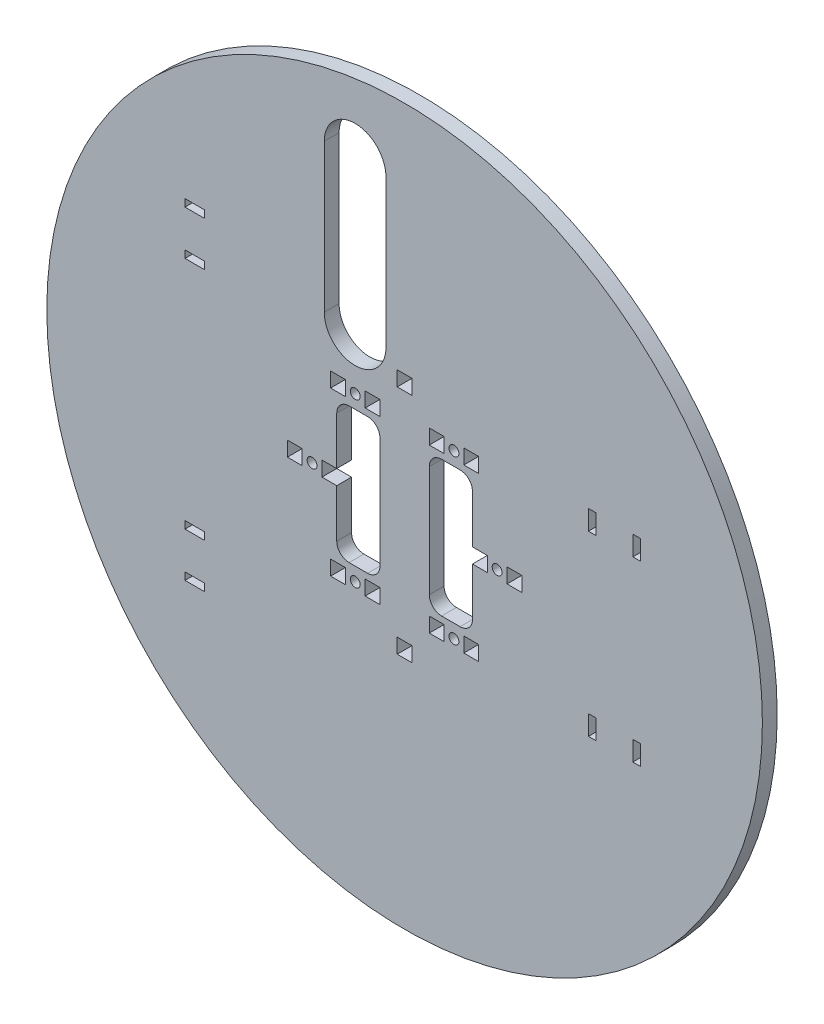
from build123d import *

# Parameters (mm, degrees)
ESQUISSE1_R             = 145
ESQUISSE1_R_2           = 2
ESQUISSE1_W             = 6
ESQUISSE1_H             = 6
BOSS_EXTRU_1_DEPTH      = 6
ESQUISSE2_W             = 17.5
ESQUISSE2_H             = 55
ESQUISSE2_W_2           = 3
ESQUISSE2_H_2           = 8
ESQUISSE2_W_3           = 8
ESQUISSE2_H_3           = 3
ENL_V_MAT_EXTRU_1_DEPTH = 6
CONG_1_R                = 5


with BuildPart() as part:
    # Esquisse1 → Boss.-Extru.1 (new body)
    with BuildSketch(Plane.XY):
        Circle(ESQUISSE1_R)
        with Locations((-37.5, 0)):
            Circle(ESQUISSE1_R_2, mode=Mode.SUBTRACT)
        with Locations((-20, -33)):
            Circle(ESQUISSE1_R_2, mode=Mode.SUBTRACT)
        with Locations((20, -33)):
            Circle(ESQUISSE1_R_2, mode=Mode.SUBTRACT)
        with Locations((20, 33)):
            Circle(ESQUISSE1_R_2, mode=Mode.SUBTRACT)
        with Locations((-20, 33)):
            Circle(ESQUISSE1_R_2, mode=Mode.SUBTRACT)
        with Locations((37.5, 0)):
            Circle(ESQUISSE1_R_2, mode=Mode.SUBTRACT)
        with Locations((0, -46.909918854)):
            Rectangle(ESQUISSE1_W, ESQUISSE1_H, mode=Mode.SUBTRACT)
        with Locations((0, 46.909918854)):
            Rectangle(ESQUISSE1_W, ESQUISSE1_H, mode=Mode.SUBTRACT)
        with Locations((-44.5, 0)):
            Rectangle(ESQUISSE1_W, ESQUISSE1_H, mode=Mode.SUBTRACT)
        with Locations((-30.5, 0)):
            Rectangle(ESQUISSE1_W, ESQUISSE1_H, mode=Mode.SUBTRACT)
        with Locations((-27, -33)):
            Rectangle(ESQUISSE1_W, ESQUISSE1_H, mode=Mode.SUBTRACT)
        with Locations((-13, -33)):
            Rectangle(ESQUISSE1_W, ESQUISSE1_H, mode=Mode.SUBTRACT)
        with Locations((13, -33)):
            Rectangle(ESQUISSE1_W, ESQUISSE1_H, mode=Mode.SUBTRACT)
        with Locations((27, -33)):
            Rectangle(ESQUISSE1_W, ESQUISSE1_H, mode=Mode.SUBTRACT)
        with Locations((13, 33)):
            Rectangle(ESQUISSE1_W, ESQUISSE1_H, mode=Mode.SUBTRACT)
        with Locations((27, 33)):
            Rectangle(ESQUISSE1_W, ESQUISSE1_H, mode=Mode.SUBTRACT)
        with Locations((-27, 33)):
            Rectangle(ESQUISSE1_W, ESQUISSE1_H, mode=Mode.SUBTRACT)
        with Locations((-13, 33)):
            Rectangle(ESQUISSE1_W, ESQUISSE1_H, mode=Mode.SUBTRACT)
        with Locations((30.5, 0)):
            Rectangle(ESQUISSE1_W, ESQUISSE1_H, mode=Mode.SUBTRACT)
        with Locations((44.5, 0)):
            Rectangle(ESQUISSE1_W, ESQUISSE1_H, mode=Mode.SUBTRACT)
    extrude(amount=BOSS_EXTRU_1_DEPTH)

    # Esquisse2 → Enlèv. mat.-Extru.1 (cut)
    with BuildSketch(Plane.XY.offset(6)):
        with Locations((-18.75, 0)):
            Rectangle(ESQUISSE2_W, ESQUISSE2_H)
        with Locations((18.75, 0)):
            Rectangle(ESQUISSE2_W, ESQUISSE2_H)
        with Locations((76, 36)):
            Rectangle(ESQUISSE2_W_2, ESQUISSE2_H_2)
        with Locations((94, 36)):
            Rectangle(ESQUISSE2_W_2, ESQUISSE2_H_2)
        with Locations((76, -36)):
            Rectangle(ESQUISSE2_W_2, ESQUISSE2_H_2)
        with Locations((94, -36)):
            Rectangle(ESQUISSE2_W_2, ESQUISSE2_H_2)
        with Locations((-85, -47.5)):
            Rectangle(ESQUISSE2_W_3, ESQUISSE2_H_3)
        with Locations((-85, 65.5)):
            Rectangle(ESQUISSE2_W_3, ESQUISSE2_H_3)
        with Locations((-85, 47.5)):
            Rectangle(ESQUISSE2_W_3, ESQUISSE2_H_3)
        with Locations((-85, -65.5)):
            Rectangle(ESQUISSE2_W_3, ESQUISSE2_H_3)
        with BuildLine():
            Line((-32.555083478, 55.362694963), (-32.555083478, 115.362694963))
            ThreePointArc((-32.555083478, 115.362694963), (-20.055083478, 127.862694963), (-7.555083478, 115.362694963))
            Line((-7.555083478, 115.362694963), (-7.555083478, 55.362694963))
            ThreePointArc((-7.555083478, 55.362694963), (-20.055083478, 42.862694963), (-32.555083478, 55.362694963))
        make_face()
    extrude(amount=-ENL_V_MAT_EXTRU_1_DEPTH, mode=Mode.SUBTRACT)

    # Congé1
    cong_1_edges = [part.edges().sort_by_distance(p)[0] for p in [
        (27.5, 27.5, 3),
        (10, 27.5, 3),
        (27.5, -27.5, 3),
        (10, -27.5, 3),
        (-27.5, -27.5, 3),
        (-27.5, 27.5, 3),
        (-10, 27.5, 3),
        (-10, -27.5, 3),
    ]]
    fillet(cong_1_edges, radius=CONG_1_R)


solid = part.part
